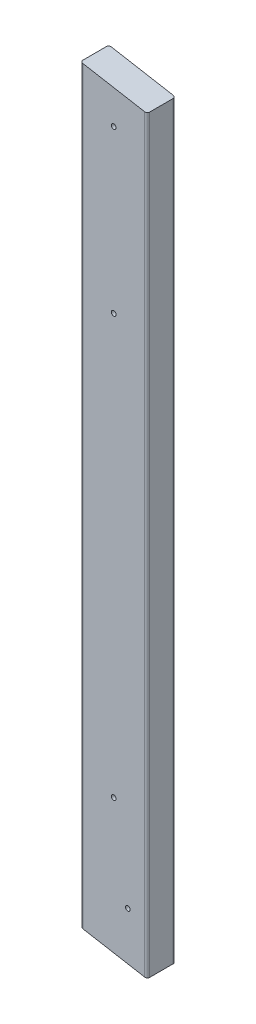
from build123d import *

# Parameters (mm, degrees)
SKETCH1_W                   = 88.9
SKETCH1_H                   = 38.1
BOSS_EXTRUDE1_DEPTH         = 1016
CUT_EXTRUDE1_DEPTH          = 1018.685320961
F_1_4_0_25_DIAMETER_HOLE1_D = 6.35
FILLET1_R                   = 3.175


with BuildPart() as part:
    # Sketch1 → Boss-Extrude1 (new body)
    with BuildSketch(Plane(origin=(0, 0, 0), x_dir=(1, 0, 0), z_dir=(0, 1, 0))):
        Rectangle(SKETCH1_W, SKETCH1_H)
    extrude(amount=BOSS_EXTRUDE1_DEPTH)

    # Sketch2 → Cut-Extrude1 (cut, through all)
    with BuildSketch(Plane.XY.offset(19.05)):
        Polygon((44.45, 0), (-44.45, 0), (-44.45, 15.675468585), align=None)
        Polygon((-44.45, 1016), (44.45, 1000.324531415), (44.45, 1016), align=None)
    extrude(amount=-CUT_EXTRUDE1_DEPTH, mode=Mode.SUBTRACT)

    # 1/4 (0.25) Diameter Hole1 (through all)
    with Locations(Plane.XY.offset(19.05)):
        with Locations((18.786968779, 68.737585765), (0, 187.400991466), (0, 747.126552809), (0, 963.026552809)):
            Hole(F_1_4_0_25_DIAMETER_HOLE1_D / 2)

    # Fillet1
    fillet1_edges = [part.edges().sort_by_distance(p)[0] for p in [
        (44.45, 500.162265708, -19.05),
        (44.45, 500.162265708, 19.05),
        (-44.45, 515.837734292, -19.05),
        (-44.45, 515.837734292, 19.05),
    ]]
    fillet(fillet1_edges, radius=FILLET1_R)


solid = part.part
